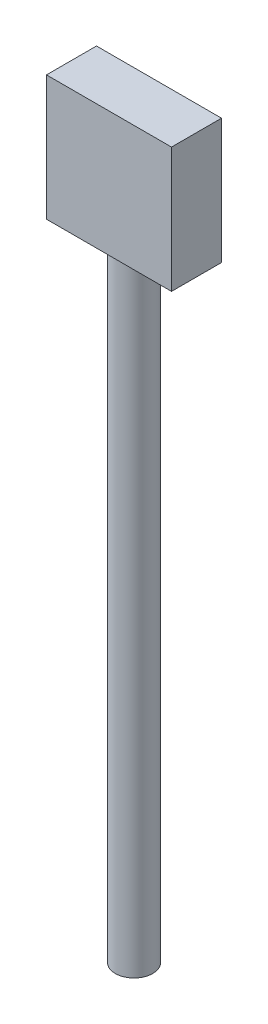
from build123d import *

# Parameters (mm, degrees)
SKETCH1_R           = 1.5
BOSS_EXTRUDE1_DEPTH = 50
SKETCH2_W           = 10
SKETCH2_H           = 4
BOSS_EXTRUDE2_DEPTH = 10


with BuildPart() as part:
    # Sketch1 → Boss-Extrude1 (new body)
    with BuildSketch(Plane(origin=(0, 0, 0), x_dir=(1, 0, 0), z_dir=(0, 1, 0))):
        with Locations(Location((0, 0, 0), (0, 0, 270))):
            Circle(SKETCH1_R)
    extrude(amount=BOSS_EXTRUDE1_DEPTH)

    # Sketch2 → Boss-Extrude2 (add)
    with BuildSketch(Plane(origin=(0, 50, 0), x_dir=(1, 0, 0), z_dir=(0, 1, 0))):
        Rectangle(SKETCH2_W, SKETCH2_H)
    extrude(amount=BOSS_EXTRUDE2_DEPTH)


solid = part.part
